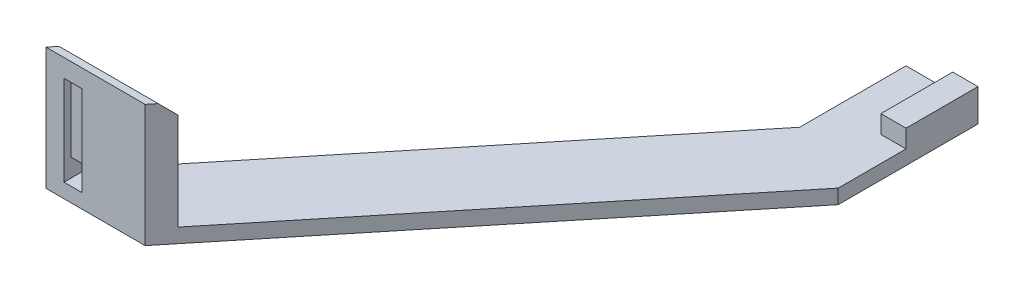
from build123d import *

# Parameters (mm, degrees)
BOSS_EXTRUDE1_DEPTH = 4
SKETCH4_W           = 7
SKETCH4_H           = 20
BOSS_EXTRUDE3_DEPTH = 5
BOSS_EXTRUDE4_DEPTH = 30
SKETCH6_W           = 5
SKETCH6_H           = 5
CUT_EXTRUDE2_DEPTH  = 30
SKETCH7_W           = 5
SKETCH7_H           = 5
BOSS_EXTRUDE5_DEPTH = 2
CHAMFER1_SIZE       = 3


with BuildPart() as part:
    # Sketch1 → Boss-Extrude1 (new body)
    with BuildSketch(Plane(origin=(0, 0, 0), x_dir=(1, 0, 0), z_dir=(0, 1, 0))):
        Polygon((-114, 0), (-86.446344316, 0), (0, 106.160035841), (0, 140), (0, 145), (-20, 145), (-20, 115.438596491), align=None)
    extrude(amount=BOSS_EXTRUDE1_DEPTH)

    # Sketch4 → Boss-Extrude3 (add)
    with BuildSketch(Plane(origin=(0, 4, 0), x_dir=(1, 0, 0), z_dir=(0, 1, 0))):
        with Locations((-3.5, 135)):
            Rectangle(SKETCH4_W, SKETCH4_H)
    extrude(amount=BOSS_EXTRUDE3_DEPTH)

    # Sketch5 → Boss-Extrude4 (add)
    with BuildSketch(Plane(origin=(0, 4, 0), x_dir=(1, 0, 0), z_dir=(0, 1, 0))):
        Polygon((-86.446344316, 0), (-104, 0), (-104, 2), (-109, 2), (-109, 0), (-114, 0), (-109.928571429, 5), (-82.374833619, 5), align=None)
    extrude(amount=BOSS_EXTRUDE4_DEPTH)

    # Sketch6 → Cut-Extrude2 (cut)
    with BuildSketch(Plane.XY.offset(-2)):
        with Locations((-106.5, 6.5)):
            Rectangle(SKETCH6_W, SKETCH6_H)
    extrude(amount=-CUT_EXTRUDE2_DEPTH, mode=Mode.SUBTRACT)

    # Sketch7 → Boss-Extrude5 (add)
    with BuildSketch(Plane.XY.offset(-2)):
        with Locations((-106.5, 31.5)):
            Rectangle(SKETCH7_W, SKETCH7_H)
    extrude(amount=BOSS_EXTRUDE5_DEPTH)

    # Chamfer1
    chamfer1_edges = [part.edges().sort_by_distance(p)[0] for p in [
        (-96.151702524, 34, -5),
    ]]
    chamfer(chamfer1_edges, length=CHAMFER1_SIZE)


solid = part.part
